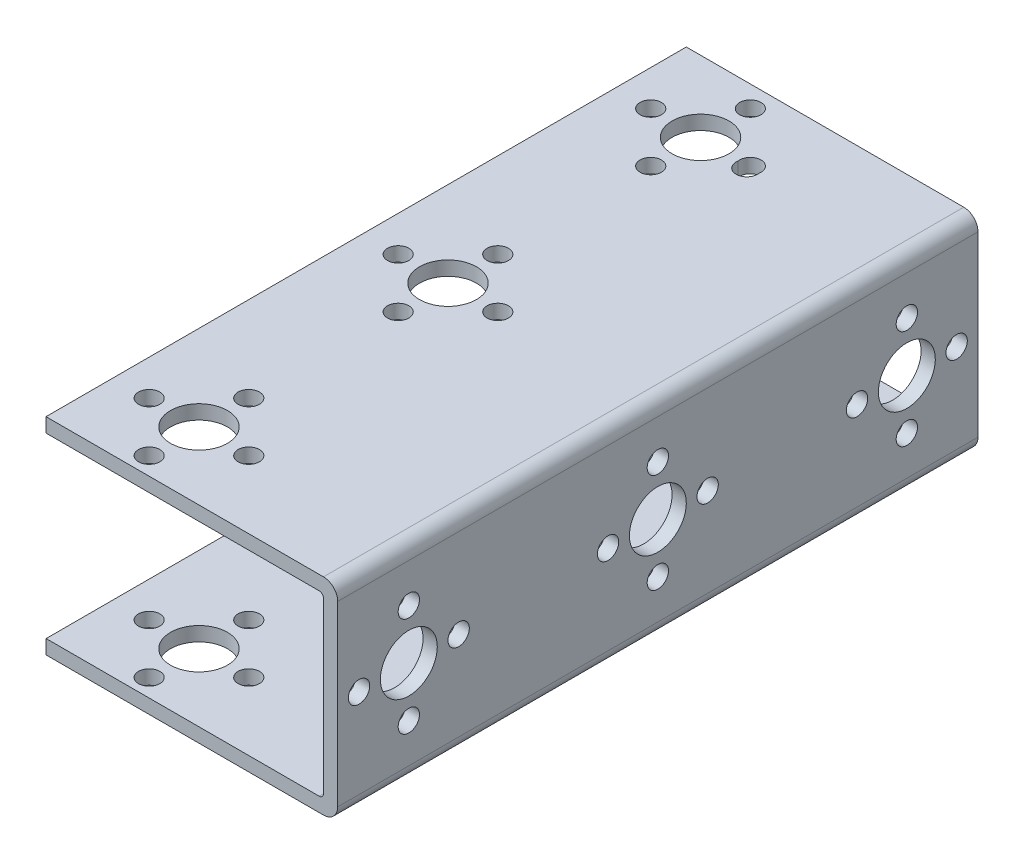
from build123d import *

# Parameters (mm, degrees)
BOSS_EXTRUDE1_DEPTH   = 90
SKETCH4_R             = 1.5
SKETCH4_R_2           = 4
CUT_EXTRUDE1_DEPTH    = 31
SKETCH6_R             = 4
SKETCH6_R_2           = 1.5
CUT_EXTRUDE2_DEPTH    = 31
CROQUIS3_R            = 4
CROQUIS3_R_2          = 1.5
CORTAR_EXTRUIR1_DEPTH = 10
CROQUIS6_R            = 4
CROQUIS6_R_2          = 1.5
CORTAR_EXTRUIR2_DEPTH = 10


with BuildPart() as part:
    # Sketch3 → Boss-Extrude1 (new body)
    with BuildSketch(Plane.XY):
        with BuildLine():
            Line((-2, 0.049393959), (-41, 0.049393959))
            Line((-41, 0.049393959), (-41, 2.049393959))
            Line((-41, 2.049393959), (-2.618272552, 2.049393959))
            ThreePointArc((-2.618272552, 2.049393959), (-2.194008483, 2.22512989), (-2.018272552, 2.649393959))
            Line((-2.018272552, 2.649393959), (-2.018272552, 26.449393959))
            ThreePointArc((-2.018272552, 26.449393959), (-2.194008483, 26.873658027), (-2.618272552, 27.049393959))
            Line((-2.618272552, 27.049393959), (-41.018189082, 27.049393959))
            Line((-41.018189082, 27.049393959), (-41.018189082, 29.049393959))
            Line((-41.018189082, 29.049393959), (-2.018189082, 29.049393959))
            ThreePointArc((-2.018189082, 29.049393959), (-0.60397552, 28.463607521), (-0.018189082, 27.049393959))
            Line((-0.018189082, 27.049393959), (-0.018189082, 2.049393959))
            ThreePointArc((-0.018189082, 2.049393959), (-0.597554333, 0.64159652), (-2, 0.049393959))
        make_face()
    extrude(amount=BOSS_EXTRUDE1_DEPTH)

    # Sketch4 → Cut-Extrude1 (cut)
    with BuildSketch(Plane(origin=(0, 29.049393959, 0), x_dir=(1, 0, 0), z_dir=(0, 1, 0))):
        with Locations(Location((-29.018189082, -3, 0), (0, 0, 180))):
            Circle(SKETCH4_R)
        with Locations(Location((-36.018189082, -10, 0), (0, 0, 180))):
            Circle(SKETCH4_R)
        with Locations(Location((-29.018189082, -10, 0), (0, 0, 180))):
            Circle(SKETCH4_R_2)
        with Locations(Location((-22.018189082, -10, 0), (0, 0, 180))):
            Circle(SKETCH4_R)
        with Locations(Location((-29.018189082, -17, 0), (0, 0, 180))):
            Circle(SKETCH4_R)
    extrude(amount=-CUT_EXTRUDE1_DEPTH, mode=Mode.SUBTRACT)

    # Sketch6 → Cut-Extrude2 (cut)
    with BuildSketch(Plane(origin=(0, 29.049393959, 0), x_dir=(1, 0, 0), z_dir=(0, 1, 0))):
        with Locations(Location((-29.018189082, -45.498892055, 0), (0, 0, 180))):
            Circle(SKETCH6_R)
        with Locations(Location((-29.018189082, -80.498892055, 0), (0, 0, 180))):
            Circle(SKETCH6_R)
        with Locations(Location((-36.018189082, -45.498892055, 0), (0, 0, 180))):
            Circle(SKETCH6_R_2)
        with Locations(Location((-36.018189082, -80.498892055, 0), (0, 0, 180))):
            Circle(SKETCH6_R_2)
        with Locations((5.981810918, -52.498892055)):
            Circle(SKETCH6_R_2)
        with Locations(Location((-29.018189082, -52.498892055, 0), (0, 0, 180))):
            Circle(SKETCH6_R_2)
        with Locations((-22.018189082, -10.498892055)):
            Circle(SKETCH6_R_2)
        with Locations(Location((-22.018189082, -45.498892055, 0), (0, 0, 180))):
            Circle(SKETCH6_R_2)
        with Locations((-64.018189082, -38.498892055)):
            Circle(SKETCH6_R_2)
        with Locations(Location((-29.018189082, -38.498892055, 0), (0, 0, 180))):
            Circle(SKETCH6_R_2)
        with Locations(Location((-29.018189082, -73.498892055, 0), (0, 0, 180))):
            Circle(SKETCH6_R_2)
        with Locations(Location((-22.018189082, -80.498892055, 0), (0, 0, 180))):
            Circle(SKETCH6_R_2)
        with Locations(Location((-29.018189082, -87.498892055, 0), (0, 0, 180))):
            Circle(SKETCH6_R_2)
    extrude(amount=-CUT_EXTRUDE2_DEPTH, mode=Mode.SUBTRACT)

    # Croquis3 → Cortar-Extruir1 (cut)
    with BuildSketch(Plane(origin=(-0.018189082, 0, 0), x_dir=(0, 0, -1), z_dir=(1, 0, 0))):
        with Locations(Location((-45, 14.549393959, 0), (0, 0, 90))):
            Circle(CROQUIS3_R)
        with Locations(Location((-38, 14.549393959, 0), (0, 0, 90))):
            Circle(CROQUIS3_R_2)
        with Locations(Location((-45, 21.549393959, 0), (0, 0, 90))):
            Circle(CROQUIS3_R_2)
        with Locations(Location((-45, 7.549393959, 0), (0, 0, 90))):
            Circle(CROQUIS3_R_2)
        with Locations(Location((-52, 14.549393959, 0), (0, 0, 90))):
            Circle(CROQUIS3_R_2)
    extrude(amount=-CORTAR_EXTRUIR1_DEPTH, mode=Mode.SUBTRACT)

    # Croquis6 → Cortar-Extruir2 (cut)
    with BuildSketch(Plane(origin=(-0.018189082, 0, 0), x_dir=(0, 0, -1), z_dir=(1, 0, 0))):
        with Locations(Location((-10, 14.549393959, 0), (0, 0, 90))):
            Circle(CROQUIS6_R)
        with Locations(Location((-3, 14.549393959, 0), (0, 0, 90))):
            Circle(CROQUIS6_R_2)
        with Locations(Location((-17, 14.549393959, 0), (0, 0, 90))):
            Circle(CROQUIS6_R_2)
        with Locations(Location((-10, 21.549393959, 0), (0, 0, 90))):
            Circle(CROQUIS6_R_2)
        with Locations(Location((-10, 7.549393959, 0), (0, 0, 90))):
            Circle(CROQUIS6_R_2)
        with Locations((-87, 14.549393959)):
            Circle(CROQUIS6_R_2)
        with Locations((-80, 7.549393959)):
            Circle(CROQUIS6_R_2)
        with Locations((-80, 21.549393959)):
            Circle(CROQUIS6_R_2)
        with Locations((-80, 14.549393959)):
            Circle(CROQUIS6_R)
        with Locations((-73, 14.549393959)):
            Circle(CROQUIS6_R_2)
    extrude(amount=-CORTAR_EXTRUIR2_DEPTH, mode=Mode.SUBTRACT)


solid = part.part
